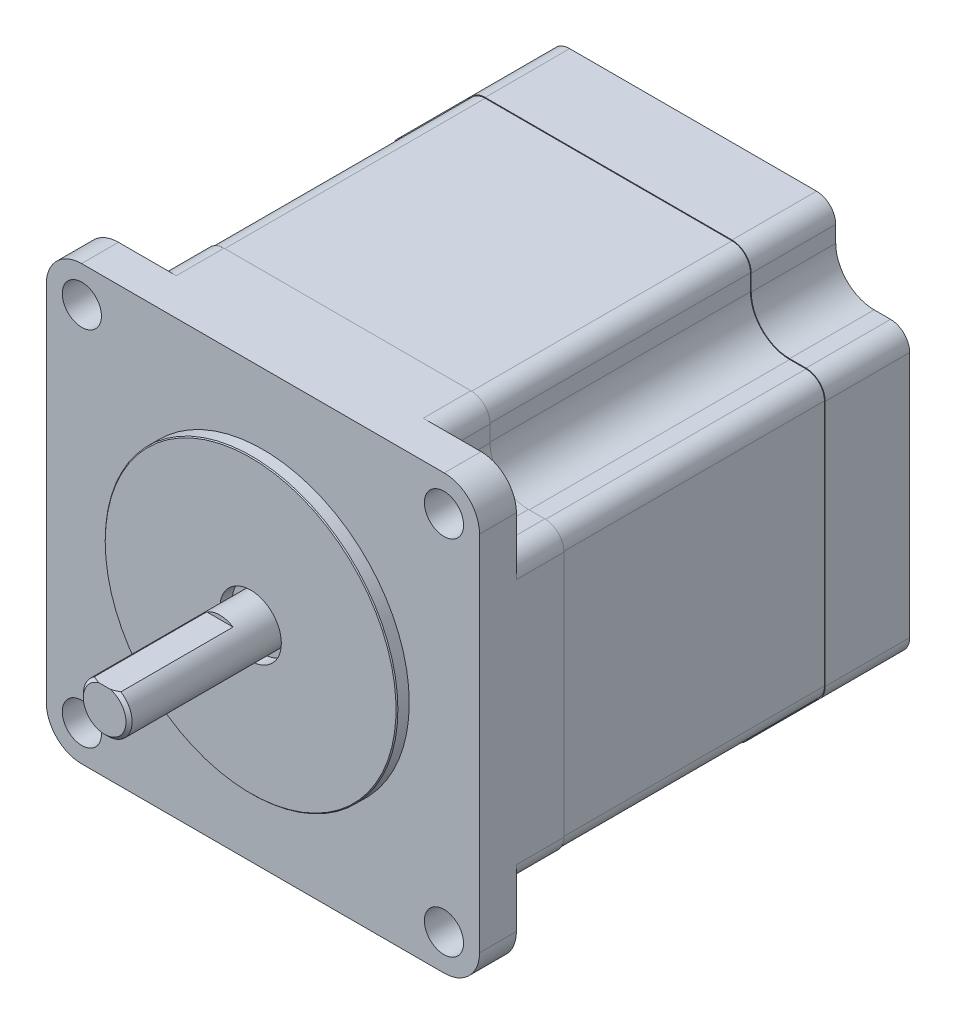
from build123d import *

# Parameters (mm, degrees)
SKETCH1_R           = 3.175
BOSS_EXTRUDE1_DEPTH = 20.6
SKETCH2_R           = 19.05
BOSS_EXTRUDE2_DEPTH = 1.6
BOSS_EXTRUDE3_DEPTH = 4.8
BOSS_EXTRUDE4_DEPTH = 51.2
SKETCH7_W           = 3.420526276
SKETCH7_H           = 1.112659396
CUT_EXTRUDE5_DEPTH  = 15
CUT_EXTRUDE6_REACH  = 70.749
SKETCH8_R           = 2.55
CUT_EXTRUDE7_DEPTH  = 17
CHAMFER1_SIZE       = 0.12
CHAMFER2_SIZE       = 0.4
SKETCH10_R          = 5.5
CUT_EXTRUDE8_DEPTH  = 5
BOSS_EXTRUDE5_START = 2.5
SKETCH11_R          = 3.175
BOSS_EXTRUDE5_DEPTH = 2.5
CHAMFER3_SIZE       = 0.4
CHAMFER4_SIZE       = 0.4
CUT_EXTRUDE9_START  = -1.6
SKETCH12_R          = 4
SKETCH12_R_2        = 3.175
CUT_EXTRUDE9_DEPTH  = 1.6


with BuildPart() as part:
    # Sketch1 → Boss-Extrude1 (new body)
    with BuildSketch(Plane.XY):
        with Locations(Location((0, 0, 0), (0, 0, 180))):
            Circle(SKETCH1_R)
    extrude(amount=BOSS_EXTRUDE1_DEPTH)

    # Sketch2 → Boss-Extrude2 (add)
    with BuildSketch(Plane(origin=(0, 0, 0), x_dir=(-1, 0, 0), z_dir=(0, 0, -1))):
        Circle(SKETCH2_R)
    extrude(amount=-BOSS_EXTRUDE2_DEPTH)

    # Sketch3 → Boss-Extrude3 (add)
    with BuildSketch(Plane(origin=(0, 0, 0), x_dir=(-1, 0, 0), z_dir=(0, 0, -1))):
        with BuildLine():
            Line((23.6, -28.2), (-23.6, -28.2))
            ThreePointArc((-23.6, -28.2), (-26.852691193, -26.852691193), (-28.2, -23.6))
            Line((-28.2, -23.6), (-28.2, 23.6))
            ThreePointArc((-28.2, 23.6), (-26.852691193, 26.852691193), (-23.6, 28.2))
            Line((-23.6, 28.2), (23.6, 28.2))
            ThreePointArc((23.6, 28.2), (26.852691193, 26.852691193), (28.2, 23.6))
            Line((28.2, 23.6), (28.2, -23.6))
            ThreePointArc((28.2, -23.6), (26.852691193, -26.852691193), (23.6, -28.2))
        make_face()
    extrude(amount=BOSS_EXTRUDE3_DEPTH)

    # Sketch4 → Boss-Extrude4 (add)
    with BuildSketch(Plane(origin=(0, 0, -4.8), x_dir=(-1, 0, 0), z_dir=(0, 0, -1))):
        with BuildLine():
            Line((-18.57, 23.57), (-18.57, 25.7))
            ThreePointArc((-18.57, 25.7), (-17.837766953, 27.467766953), (-16.07, 28.2))
            Line((-16.07, 28.2), (16.07, 28.2))
            ThreePointArc((16.07, 28.2), (17.837766953, 27.467766953), (18.57, 25.7))
            Line((18.57, 25.7), (18.57, 23.57))
            ThreePointArc((18.57, 23.57), (20.034466094, 20.034466094), (23.57, 18.57))
            Line((23.57, 18.57), (25.7, 18.57))
            ThreePointArc((25.7, 18.57), (27.467766953, 17.837766953), (28.2, 16.07))
            Line((28.2, 16.07), (28.2, -16.07))
            ThreePointArc((28.2, -16.07), (27.467766953, -17.837766953), (25.7, -18.57))
            Line((25.7, -18.57), (23.57, -18.57))
            ThreePointArc((23.57, -18.57), (20.034466094, -20.034466094), (18.57, -23.57))
            Line((18.57, -23.57), (18.57, -25.7))
            ThreePointArc((18.57, -25.7), (17.837766953, -27.467766953), (16.07, -28.2))
            Line((16.07, -28.2), (-16.07, -28.2))
            ThreePointArc((-16.07, -28.2), (-17.837766953, -27.467766953), (-18.57, -25.7))
            Line((-18.57, -25.7), (-18.57, -23.57))
            ThreePointArc((-18.57, -23.57), (-20.034466094, -20.034466094), (-23.57, -18.57))
            Line((-23.57, -18.57), (-25.7, -18.57))
            ThreePointArc((-25.7, -18.57), (-27.467766953, -17.837766953), (-28.2, -16.07))
            Line((-28.2, -16.07), (-28.2, 16.07))
            ThreePointArc((-28.2, 16.07), (-27.467766953, 17.837766953), (-25.7, 18.57))
            Line((-25.7, 18.57), (-23.57, 18.57))
            ThreePointArc((-23.57, 18.57), (-20.034466094, 20.034466094), (-18.57, 23.57))
        make_face()
    extrude(amount=BOSS_EXTRUDE4_DEPTH)

    # Sketch7 → Cut-Extrude5 (cut)
    with BuildSketch(Plane.XY.offset(20.6)):
        with Locations((0, 3.231329698)):
            Rectangle(SKETCH7_W, SKETCH7_H)
    extrude(amount=-CUT_EXTRUDE5_DEPTH, mode=Mode.SUBTRACT)

    # Sketch8 → Cut-Extrude6 (cut, up to next)
    with BuildSketch(Plane.XY, mode=Mode.PRIVATE) as cut_extrude6_sk1:
        with Locations((-23.57, 23.57)):
            Circle(SKETCH8_R)
    cut_extrude6_tool1 = extrude(cut_extrude6_sk1.sketch, amount=-CUT_EXTRUDE6_REACH, mode=Mode.PRIVATE) & part.part
    # Sketch8 → Cut-Extrude6 (cut, up to next)
    with BuildSketch(Plane.XY, mode=Mode.PRIVATE) as cut_extrude6_sk2:
        with Locations((23.57, 23.57)):
            Circle(SKETCH8_R)
    cut_extrude6_tool2 = extrude(cut_extrude6_sk2.sketch, amount=-CUT_EXTRUDE6_REACH, mode=Mode.PRIVATE) & part.part
    # Sketch8 → Cut-Extrude6 (cut, up to next)
    with BuildSketch(Plane.XY, mode=Mode.PRIVATE) as cut_extrude6_sk3:
        with Locations((23.57, -23.57)):
            Circle(SKETCH8_R)
    cut_extrude6_tool3 = extrude(cut_extrude6_sk3.sketch, amount=-CUT_EXTRUDE6_REACH, mode=Mode.PRIVATE) & part.part
    # Sketch8 → Cut-Extrude6 (cut, up to next)
    with BuildSketch(Plane.XY, mode=Mode.PRIVATE) as cut_extrude6_sk4:
        with Locations((-23.57, -23.57)):
            Circle(SKETCH8_R)
    cut_extrude6_tool4 = extrude(cut_extrude6_sk4.sketch, amount=-CUT_EXTRUDE6_REACH, mode=Mode.PRIVATE) & part.part
    add(cut_extrude6_tool1.solids().sort_by_distance((-23.57, 23.57, 0))[0], mode=Mode.SUBTRACT)
    add(cut_extrude6_tool2.solids().sort_by_distance((23.57, 23.57, 0))[0], mode=Mode.SUBTRACT)
    add(cut_extrude6_tool3.solids().sort_by_distance((23.57, -23.57, 0))[0], mode=Mode.SUBTRACT)
    add(cut_extrude6_tool4.solids().sort_by_distance((-23.57, -23.57, 0))[0], mode=Mode.SUBTRACT)

    # Sketch9 → Cut-Extrude7 (cut, symmetric)
    with BuildSketch(Plane.XY.offset(-28)):
        with BuildLine():
            Line((18.57, 23.57), (18.57, 25.7))
            ThreePointArc((18.57, 25.7), (17.837766953, 27.467766953), (16.07, 28.2))
            Line((16.07, 28.2), (-16.07, 28.2))
            ThreePointArc((-16.07, 28.2), (-17.837766953, 27.467766953), (-18.57, 25.7))
            Line((-18.57, 25.7), (-18.57, 23.57))
            ThreePointArc((-18.57, 23.57), (-20.034466094, 20.034466094), (-23.57, 18.57))
            Line((-23.57, 18.57), (-25.7, 18.57))
            ThreePointArc((-25.7, 18.57), (-27.467766953, 17.837766953), (-28.2, 16.07))
            Line((-28.2, 16.07), (-28.2, -16.07))
            ThreePointArc((-28.2, -16.07), (-27.467766953, -17.837766953), (-25.7, -18.57))
            Line((-25.7, -18.57), (-23.57, -18.57))
            ThreePointArc((-23.57, -18.57), (-20.034466094, -20.034466094), (-18.57, -23.57))
            Line((-18.57, -23.57), (-18.57, -25.7))
            ThreePointArc((-18.57, -25.7), (-17.837766953, -27.467766953), (-16.07, -28.2))
            Line((-16.07, -28.2), (16.07, -28.2))
            ThreePointArc((16.07, -28.2), (17.837766953, -27.467766953), (18.57, -25.7))
            Line((18.57, -25.7), (18.57, -23.57))
            ThreePointArc((18.57, -23.57), (20.034466094, -20.034466094), (23.57, -18.57))
            Line((23.57, -18.57), (25.7, -18.57))
            ThreePointArc((25.7, -18.57), (27.467766953, -17.837766953), (28.2, -16.07))
            Line((28.2, -16.07), (28.2, 16.07))
            ThreePointArc((28.2, 16.07), (27.467766953, 17.837766953), (25.7, 18.57))
            Line((25.7, 18.57), (23.57, 18.57))
            ThreePointArc((23.57, 18.57), (20.034466094, 20.034466094), (18.57, 23.57))
        make_face()
        with BuildLine():
            Line((18.47, 23.57), (18.47, 25.7))
            ThreePointArc((18.47, 25.7), (17.767056275, 27.397056275), (16.07, 28.1))
            Line((16.07, 28.1), (-16.07, 28.1))
            ThreePointArc((-16.07, 28.1), (-17.767056275, 27.397056275), (-18.47, 25.7))
            Line((-18.47, 25.7), (-18.47, 23.57))
            ThreePointArc((-18.47, 23.57), (-19.963755416, 19.963755416), (-23.57, 18.47))
            Line((-23.57, 18.47), (-25.7, 18.47))
            ThreePointArc((-25.7, 18.47), (-27.397056275, 17.767056275), (-28.1, 16.07))
            Line((-28.1, 16.07), (-28.1, -16.07))
            ThreePointArc((-28.1, -16.07), (-27.397056275, -17.767056275), (-25.7, -18.47))
            Line((-25.7, -18.47), (-23.57, -18.47))
            ThreePointArc((-23.57, -18.47), (-19.963755416, -19.963755416), (-18.47, -23.57))
            Line((-18.47, -23.57), (-18.47, -25.7))
            ThreePointArc((-18.47, -25.7), (-17.767056275, -27.397056275), (-16.07, -28.1))
            Line((-16.07, -28.1), (16.07, -28.1))
            ThreePointArc((16.07, -28.1), (17.767056275, -27.397056275), (18.47, -25.7))
            Line((18.47, -25.7), (18.47, -23.57))
            ThreePointArc((18.47, -23.57), (19.963755416, -19.963755416), (23.57, -18.47))
            Line((23.57, -18.47), (25.7, -18.47))
            ThreePointArc((25.7, -18.47), (27.397056275, -17.767056275), (28.1, -16.07))
            Line((28.1, -16.07), (28.1, 16.07))
            ThreePointArc((28.1, 16.07), (27.397056275, 17.767056275), (25.7, 18.47))
            Line((25.7, 18.47), (23.57, 18.47))
            ThreePointArc((23.57, 18.47), (19.963755416, 19.963755416), (18.47, 23.57))
        make_face(mode=Mode.SUBTRACT)
    extrude(amount=CUT_EXTRUDE7_DEPTH, both=True, mode=Mode.SUBTRACT)

    # Chamfer1
    chamfer1_edges = [part.edges().sort_by_distance(p)[0] for p in [
        (19.05, 0, 1.6),
    ]]
    chamfer(chamfer1_edges, length=CHAMFER1_SIZE)

    # Chamfer2
    chamfer2_edges = [part.edges().sort_by_distance(p)[0] for p in [
        (1.524883526, -2.784843843, 20.6),
    ]]
    chamfer(chamfer2_edges, length=CHAMFER2_SIZE)

    # Sketch10 → Cut-Extrude8 (cut)
    with BuildSketch(Plane(origin=(0, 0, -56), x_dir=(-1, 0, 0), z_dir=(0, 0, -1))):
        Circle(SKETCH10_R)
    extrude(amount=-CUT_EXTRUDE8_DEPTH, mode=Mode.SUBTRACT)

    # Sketch11 → Boss-Extrude5 (add)
    with BuildSketch(Plane(origin=(0, 0, -51), x_dir=(-1, 0, 0), z_dir=(0, 0, -1)).offset(BOSS_EXTRUDE5_START)):
        Circle(SKETCH11_R)
    extrude(amount=-BOSS_EXTRUDE5_DEPTH)

    # Chamfer3
    chamfer3_edges = [part.edges().sort_by_distance(p)[0] for p in [
        (3.175, 0, -53.5),
    ]]
    chamfer(chamfer3_edges, length=CHAMFER3_SIZE)

    # Chamfer4
    chamfer4_edges = [part.edges().sort_by_distance(p)[0] for p in [
        (5.5, 0, -56),
    ]]
    chamfer(chamfer4_edges, length=CHAMFER4_SIZE)

    # Sketch12 → Cut-Extrude9 (cut)
    with BuildSketch(Plane.XY.offset(1.6).offset(CUT_EXTRUDE9_START)):
        Circle(SKETCH12_R)
        with Locations(Location((0, 0, 0), (0, 0, 180))):
            Circle(SKETCH12_R_2, mode=Mode.SUBTRACT)
    extrude(amount=CUT_EXTRUDE9_DEPTH, mode=Mode.SUBTRACT)


solid = part.part
